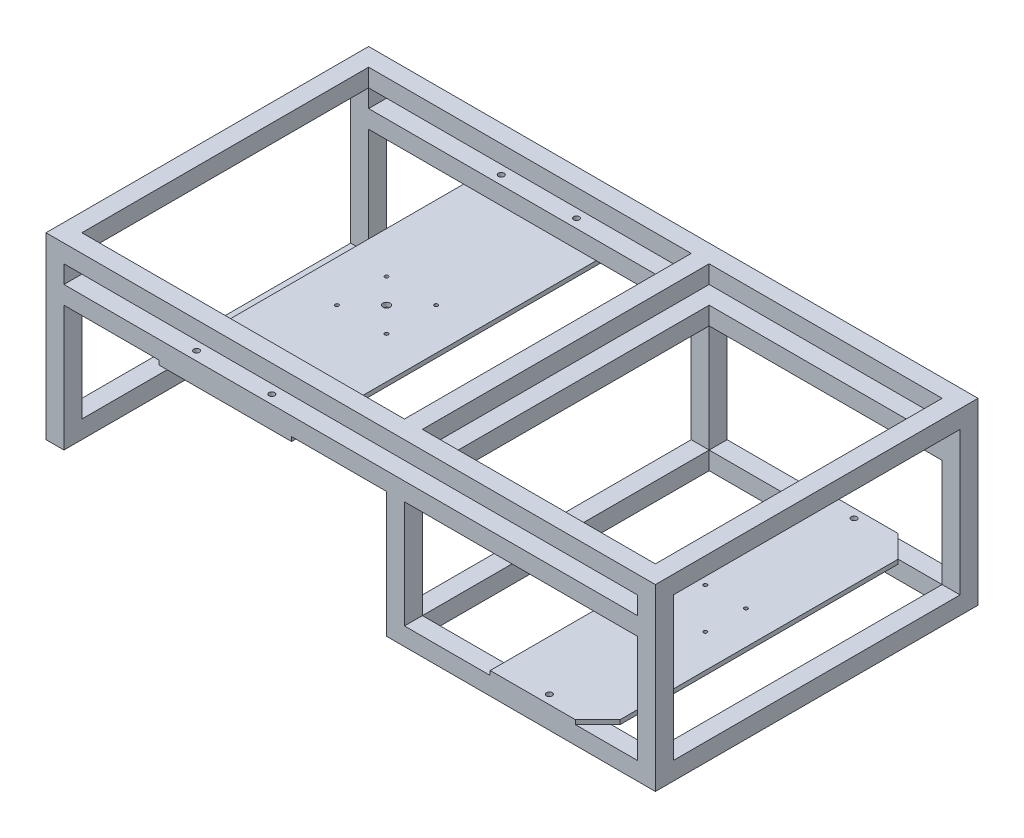
from build123d import *

# Parameters (mm, degrees)
SKETCH1_W             = 25
SKETCH1_H             = 450
BOSS_EXTRUDE2_DEPTH   = 25
BOSS_EXTRUDE2_2_DEPTH = 25
SKETCH2_W             = 25
SKETCH2_H             = 25
BOSS_EXTRUDE3_DEPTH   = 200
SKETCH3_W             = 25
SKETCH3_H             = 450
BOSS_EXTRUDE4_DEPTH   = 25
SKETCH5_W             = 25
SKETCH5_H             = 25
BOSS_EXTRUDE5_DEPTH   = 200
SKETCH6_W             = 25
SKETCH6_H             = 450
BOSS_EXTRUDE6_DEPTH   = 25
SKETCH7_W             = 800
SKETCH7_H             = 25
BOSS_EXTRUDE7_DEPTH   = 25
SKETCH8_W             = 350
SKETCH8_H             = 25
BOSS_EXTRUDE8_DEPTH   = 25
SKETCH9_W             = 25
SKETCH9_H             = 425
BOSS_EXTRUDE9_DEPTH   = 25
SKETCH10_W            = 25
SKETCH10_H            = 25
BOSS_EXTRUDE10_DEPTH  = 800
BOSS_EXTRUDE13_REACH  = 532.919
SKETCH14_W            = 25
SKETCH14_H            = 25
SKETCH15_W            = 185
SKETCH15_H            = 450
BOSS_EXTRUDE14_DEPTH  = 6
BOSS_EXTRUDE15_DEPTH  = 6
CUT_EXTRUDE2_REACH    = 511.717
SKETCH19_R            = 4
CUT_EXTRUDE4_REACH    = 530.404
SKETCH20_R            = 4
SKETCH21_R            = 5
SKETCH21_R_2          = 2.5
CUT_EXTRUDE5_DEPTH    = 10
BOSS_EXTRUDE16_REACH  = 652.961
SKETCH24_W            = 25
SKETCH24_H            = 25
SKETCH25_R            = 2.5
CUT_EXTRUDE6_DEPTH    = 10


with BuildPart() as part:
    # Sketch1 → Boss-Extrude2 (new body)
    with BuildSketch(Plane(origin=(0, 0, 0), x_dir=(1, 0, 0), z_dir=(0, 1, 0))):
        with Locations((-412.5, 0)):
            Rectangle(SKETCH1_W, SKETCH1_H)
    extrude(amount=BOSS_EXTRUDE2_DEPTH)

    # Sketch2 → Boss-Extrude3 (add)
    with BuildSketch(Plane(origin=(0, 25, 0), x_dir=(1, 0, 0), z_dir=(0, 1, 0))):
        with Locations((-412.5, 212.5)):
            Rectangle(SKETCH2_W, SKETCH2_H)
        with Locations((-412.5, -212.5)):
            Rectangle(SKETCH2_W, SKETCH2_H)
    extrude(amount=BOSS_EXTRUDE3_DEPTH)

    # Sketch3 → Boss-Extrude4 (add)
    with BuildSketch(Plane(origin=(0, 225, 0), x_dir=(1, 0, 0), z_dir=(0, 1, 0))):
        with Locations((-412.5, 0)):
            Rectangle(SKETCH3_W, SKETCH3_H)
    extrude(amount=BOSS_EXTRUDE4_DEPTH)



with BuildPart() as body_2:
    # Sketch1 → Boss-Extrude2 2 (new body)
    with BuildSketch(Plane(origin=(0, 0, 0), x_dir=(1, 0, 0), z_dir=(0, 1, 0))):
        with Locations((412.5, 0)):
            Rectangle(SKETCH1_W, SKETCH1_H)
    extrude(amount=BOSS_EXTRUDE2_2_DEPTH)

    # Sketch5 → Boss-Extrude5 (add)
    with BuildSketch(Plane(origin=(0, 25, 0), x_dir=(1, 0, 0), z_dir=(0, 1, 0))):
        with Locations((412.5, 212.5)):
            Rectangle(SKETCH5_W, SKETCH5_H)
        with Locations((412.5, -212.5)):
            Rectangle(SKETCH5_W, SKETCH5_H)
    extrude(amount=BOSS_EXTRUDE5_DEPTH)

    # Sketch6 → Boss-Extrude6 (add)
    with BuildSketch(Plane(origin=(0, 225, 0), x_dir=(1, 0, 0), z_dir=(0, 1, 0))):
        with Locations((412.5, 0)):
            Rectangle(SKETCH6_W, SKETCH6_H)
    extrude(amount=BOSS_EXTRUDE6_DEPTH)


with BuildPart() as part_1:
    add(part.part)

    add(body_2.part)  # Boss-Extrude7 merges body 2
    # Sketch7 → Boss-Extrude7 (add)
    with BuildSketch(Plane(origin=(0, 250, 0), x_dir=(1, 0, 0), z_dir=(0, 1, 0))):
        with Locations((0, 212.5)):
            Rectangle(SKETCH7_W, SKETCH7_H)
        with Locations((0, -212.5)):
            Rectangle(SKETCH7_W, SKETCH7_H)
    extrude(amount=-BOSS_EXTRUDE7_DEPTH)

    # Sketch8 → Boss-Extrude8 (add)
    with BuildSketch(Plane(origin=(0, 0, 0), x_dir=(-1, 0, 0), z_dir=(0, -1, 0))):
        with Locations((-225, 212.5)):
            Rectangle(SKETCH8_W, SKETCH8_H)
        with Locations((-225, -212.5)):
            Rectangle(SKETCH8_W, SKETCH8_H)
    extrude(amount=-BOSS_EXTRUDE8_DEPTH)

    # Sketch9 → Boss-Extrude9 (add)
    with BuildSketch(Plane(origin=(0, 0, 0), x_dir=(-1, 0, 0), z_dir=(0, -1, 0))):
        with Locations((-62.5, -12.5)):
            Rectangle(SKETCH9_W, SKETCH9_H)
    extrude(amount=-BOSS_EXTRUDE9_DEPTH)

    # Sketch10 → Boss-Extrude10 (add)
    with BuildSketch(Plane.ZY.offset(-400)):
        with Locations((212.5, 187.5)):
            Rectangle(SKETCH10_W, SKETCH10_H)
        with Locations((-212.5, 187.5)):
            Rectangle(SKETCH10_W, SKETCH10_H)
    extrude(amount=BOSS_EXTRUDE10_DEPTH)

    # Sketch14 → Boss-Extrude13 (add, up to next)
    with BuildSketch(Plane(origin=(0, 25, 0), x_dir=(1, 0, 0), z_dir=(0, 1, 0)), mode=Mode.PRIVATE) as boss_extrude13_sk1:
        with Locations((62.5, 212.5)):
            Rectangle(SKETCH14_W, SKETCH14_H)
    boss_extrude13_tool1 = extrude(boss_extrude13_sk1.sketch, amount=BOSS_EXTRUDE13_REACH, mode=Mode.PRIVATE) - part_1.part
    # Sketch14 → Boss-Extrude13 (add, up to next)
    with BuildSketch(Plane(origin=(0, 25, 0), x_dir=(1, 0, 0), z_dir=(0, 1, 0)), mode=Mode.PRIVATE) as boss_extrude13_sk2:
        with Locations((62.5, -212.5)):
            Rectangle(SKETCH14_W, SKETCH14_H)
    boss_extrude13_tool2 = extrude(boss_extrude13_sk2.sketch, amount=BOSS_EXTRUDE13_REACH, mode=Mode.PRIVATE) - part_1.part
    add(boss_extrude13_tool1.solids().sort_by_distance((62.5, 25, -212.5))[0])
    add(boss_extrude13_tool2.solids().sort_by_distance((62.5, 25, 212.5))[0])

    # Sketch15 → Boss-Extrude14 (add)
    with BuildSketch(Plane.XZ.offset(-175)):
        with Locations((-175, 0)):
            Rectangle(SKETCH15_W, SKETCH15_H)
    extrude(amount=BOSS_EXTRUDE14_DEPTH)

    # Sketch18 → Boss-Extrude15 (add)
    with BuildSketch(Plane(origin=(0, 25, 0), x_dir=(1, 0, 0), z_dir=(0, 1, 0))):
        Polygon((194.602808883, 225), (313.254235522, 225), (344.602808883, 193.65142664), (344.602808883, -193.65142664), (313.254235522, -225), (194.602808883, -225), align=None)
    extrude(amount=BOSS_EXTRUDE15_DEPTH)

    # Sketch19 → Cut-Extrude2 (cut, up to next)
    with BuildSketch(Plane.XZ.offset(-169), mode=Mode.PRIVATE) as cut_extrude2_sk1:
        with Locations(Location((-227.5, 212.5, 0), (0, 0, 270))):
            Circle(SKETCH19_R)
    cut_extrude2_tool1 = extrude(cut_extrude2_sk1.sketch, amount=-CUT_EXTRUDE2_REACH, mode=Mode.PRIVATE) & part_1.part
    # Sketch19 → Cut-Extrude2 (cut, up to next)
    with BuildSketch(Plane.XZ.offset(-169), mode=Mode.PRIVATE) as cut_extrude2_sk2:
        with Locations(Location((-122.5, 212.5, 0), (0, 0, 270))):
            Circle(SKETCH19_R)
    cut_extrude2_tool2 = extrude(cut_extrude2_sk2.sketch, amount=-CUT_EXTRUDE2_REACH, mode=Mode.PRIVATE) & part_1.part
    # Sketch19 → Cut-Extrude2 (cut, up to next)
    with BuildSketch(Plane.XZ.offset(-169), mode=Mode.PRIVATE) as cut_extrude2_sk3:
        with Locations(Location((-227.5, -212.5, 0), (0, 0, 270))):
            Circle(SKETCH19_R)
    cut_extrude2_tool3 = extrude(cut_extrude2_sk3.sketch, amount=-CUT_EXTRUDE2_REACH, mode=Mode.PRIVATE) & part_1.part
    # Sketch19 → Cut-Extrude2 (cut, up to next)
    with BuildSketch(Plane.XZ.offset(-169), mode=Mode.PRIVATE) as cut_extrude2_sk4:
        with Locations(Location((-122.5, -212.5, 0), (0, 0, 270))):
            Circle(SKETCH19_R)
    cut_extrude2_tool4 = extrude(cut_extrude2_sk4.sketch, amount=-CUT_EXTRUDE2_REACH, mode=Mode.PRIVATE) & part_1.part
    add(cut_extrude2_tool1.solids().sort_by_distance((-227.5, 169, 212.5))[0], mode=Mode.SUBTRACT)
    add(cut_extrude2_tool2.solids().sort_by_distance((-122.5, 169, 212.5))[0], mode=Mode.SUBTRACT)
    add(cut_extrude2_tool3.solids().sort_by_distance((-227.5, 169, -212.5))[0], mode=Mode.SUBTRACT)
    add(cut_extrude2_tool4.solids().sort_by_distance((-122.5, 169, -212.5))[0], mode=Mode.SUBTRACT)

    # Sketch20 → Cut-Extrude4 (cut, up to next)
    with BuildSketch(Plane(origin=(0, 31, 0), x_dir=(1, 0, 0), z_dir=(0, 1, 0)), mode=Mode.PRIVATE) as cut_extrude4_sk1:
        with Locations(Location((264.602808883, 212.5, 0), (0, 0, 270))):
            Circle(SKETCH20_R)
    cut_extrude4_tool1 = extrude(cut_extrude4_sk1.sketch, amount=-CUT_EXTRUDE4_REACH, mode=Mode.PRIVATE) & part_1.part
    # Sketch20 → Cut-Extrude4 (cut, up to next)
    with BuildSketch(Plane(origin=(0, 31, 0), x_dir=(1, 0, 0), z_dir=(0, 1, 0)), mode=Mode.PRIVATE) as cut_extrude4_sk2:
        with Locations(Location((264.602808883, -212.5, 0), (0, 0, 90))):
            Circle(SKETCH20_R)
    cut_extrude4_tool2 = extrude(cut_extrude4_sk2.sketch, amount=-CUT_EXTRUDE4_REACH, mode=Mode.PRIVATE) & part_1.part
    add(cut_extrude4_tool1.solids().sort_by_distance((264.602809, 31, -212.5))[0], mode=Mode.SUBTRACT)
    add(cut_extrude4_tool2.solids().sort_by_distance((264.602809, 31, 212.5))[0], mode=Mode.SUBTRACT)

    # Sketch21 → Cut-Extrude5 (cut)
    with BuildSketch(Plane.XZ.offset(-169)):
        with Locations(Location((-175, 0, 0), (0, 0, 270))):
            Circle(SKETCH21_R)
        with Locations(Location((-209.626678733, 34.626678733, 0), (0, 0, 270))):
            Circle(SKETCH21_R_2)
        with Locations(Location((-140.373321267, 34.626678733, 0), (0, 0, 270))):
            Circle(SKETCH21_R_2)
        with Locations(Location((-140.373321267, -34.626678733, 0), (0, 0, 270))):
            Circle(SKETCH21_R_2)
        with Locations(Location((-209.626678733, -34.626678733, 0), (0, 0, 270))):
            Circle(SKETCH21_R_2)
    extrude(amount=-CUT_EXTRUDE5_DEPTH, mode=Mode.SUBTRACT)

    # Sketch24 → Boss-Extrude16 (add, up to next)
    with BuildSketch(Plane.XY.offset(-200), mode=Mode.PRIVATE) as boss_extrude16_sk1:
        with Locations((62.5, 187.5)):
            Rectangle(SKETCH24_W, SKETCH24_H)
    boss_extrude16_tool1 = extrude(boss_extrude16_sk1.sketch, amount=BOSS_EXTRUDE16_REACH, mode=Mode.PRIVATE) - part_1.part
    # Sketch24 → Boss-Extrude16 (add, up to next)
    with BuildSketch(Plane.XY.offset(-200), mode=Mode.PRIVATE) as boss_extrude16_sk2:
        with Locations((62.5, 237.5)):
            Rectangle(SKETCH24_W, SKETCH24_H)
    boss_extrude16_tool2 = extrude(boss_extrude16_sk2.sketch, amount=BOSS_EXTRUDE16_REACH, mode=Mode.PRIVATE) - part_1.part
    add(boss_extrude16_tool1.solids().sort_by_distance((62.5, 187.5, -200))[0])
    add(boss_extrude16_tool2.solids().sort_by_distance((62.5, 237.5, -200))[0])

    # Sketch25 → Cut-Extrude6 (cut)
    with BuildSketch(Plane(origin=(0, 31, 0), x_dir=(1, 0, 0), z_dir=(0, 1, 0))):
        with Locations(Location((241.318537635, 28.284271247, 0), (0, 0, 270))):
            Circle(SKETCH25_R)
        with Locations(Location((297.88708013, 28.284271247, 0), (0, 0, 270))):
            Circle(SKETCH25_R)
        with Locations(Location((297.88708013, -28.284271247, 0), (0, 0, 270))):
            Circle(SKETCH25_R)
        with Locations(Location((241.318537635, -28.284271247, 0), (0, 0, 270))):
            Circle(SKETCH25_R)
    extrude(amount=-CUT_EXTRUDE6_DEPTH, mode=Mode.SUBTRACT)


solid = part_1.part
